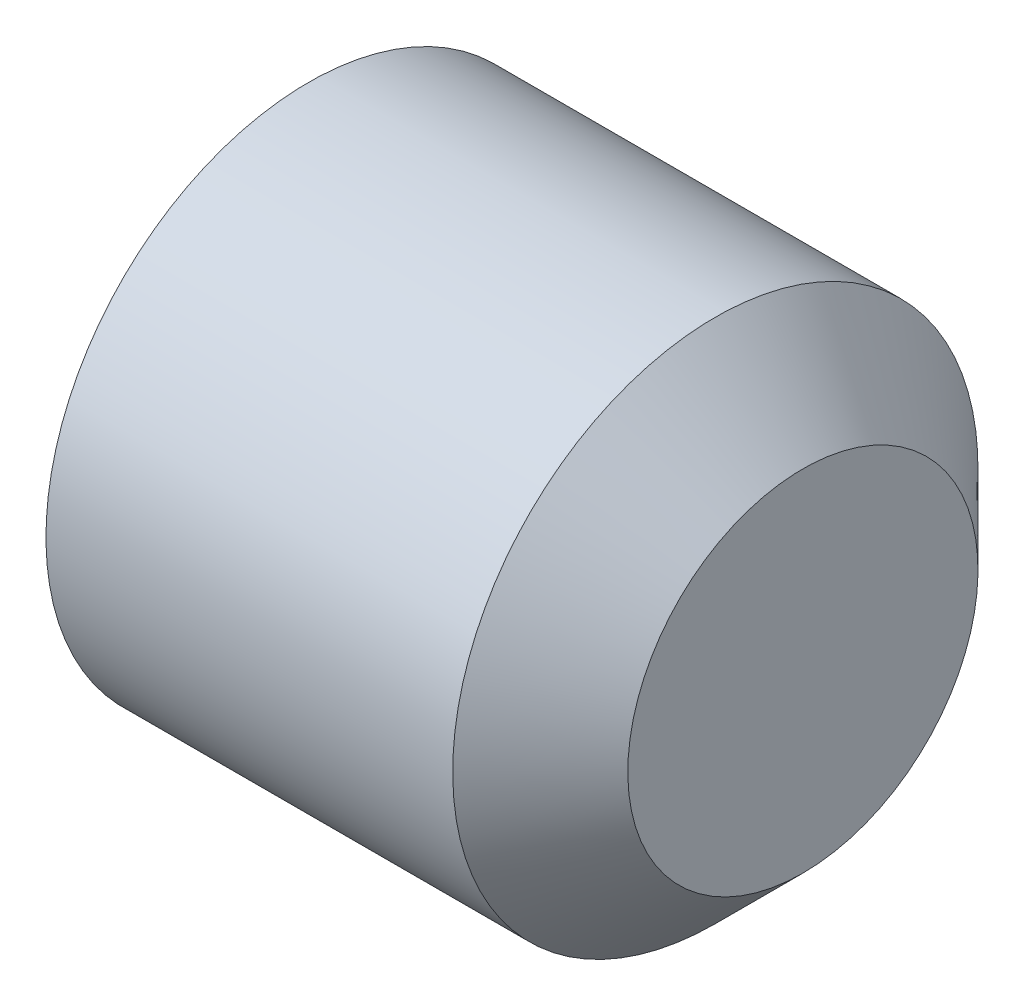
from build123d import *

# Parameters (mm, degrees)
ENL_V_MAT_EXTRU_1_DEPTH = 1.2


with BuildPart() as part:
    # Esquisse1 → Révolution1 (revolve)
    with BuildSketch(Plane.XY):
        Polygon((3, 0), (3, -1), (2.5, -1.5), (0.176957858, -1.5), (0, -1.1935), (0, -0.866025404), (0.5, 0), align=None)
    revolve(axis=Axis((0.5, 0, 0), (1, 0, 0)))

    # Esquisse2 → Enlèv. mat.-Extru.1 (cut)
    with BuildSketch(Plane(origin=(0, 0, 0), x_dir=(0, 0, -1), z_dir=(1, 0, 0))):
        Polygon((-0.866025404, 0), (-0.433012702, -0.75), (0.433012702, -0.75), (0.866025404, 0), (0.433012702, 0.75), (-0.433012702, 0.75), align=None)
    extrude(amount=ENL_V_MAT_EXTRU_1_DEPTH, mode=Mode.SUBTRACT)


solid = part.part
